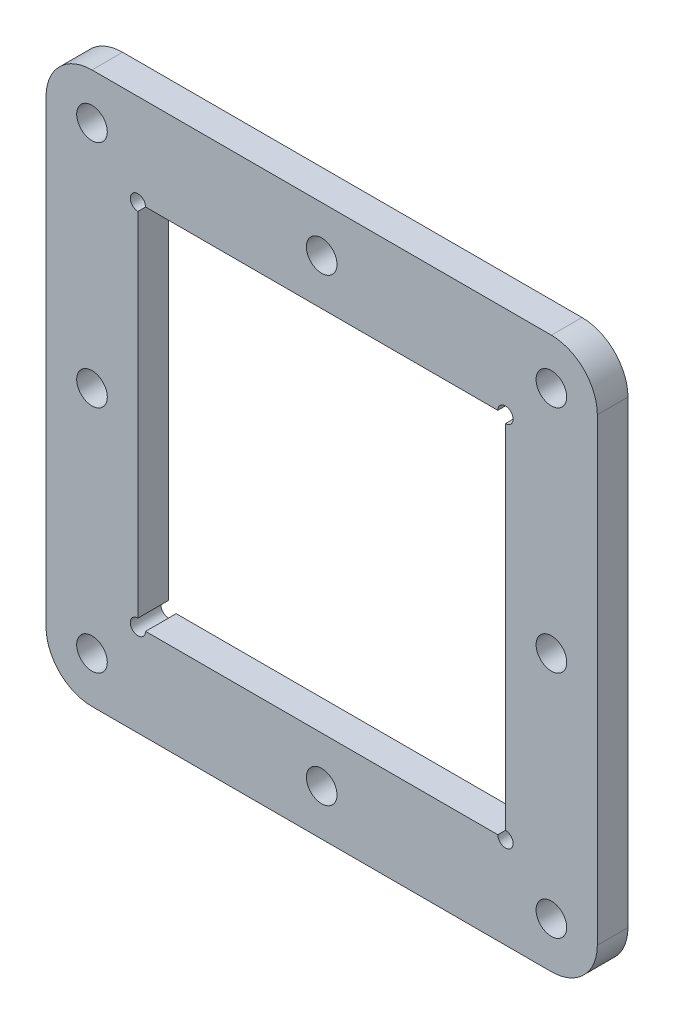
from build123d import *

# Parameters (mm, degrees)
SKETCH2_R           = 5
SKETCH2_W           = 120
SKETCH2_H           = 120
BOSS_EXTRUDE1_DEPTH = 10
SKETCH3_R           = 2.5
CUT_EXTRUDE1_DEPTH  = 10


with BuildPart() as part:
    # Sketch2 → Boss-Extrude1 (new body)
    with BuildSketch(Plane.XY):
        with BuildLine():
            Line((-75, 90), (75, 90))
            ThreePointArc((75, 90), (85.606601718, 85.606601718), (90, 75))
            Line((90, 75), (90, -75))
            ThreePointArc((90, -75), (85.606601718, -85.606601718), (75, -90))
            Line((75, -90), (-75, -90))
            ThreePointArc((-75, -90), (-85.606601718, -85.606601718), (-90, -75))
            Line((-90, -75), (-90, 75))
            ThreePointArc((-90, 75), (-85.606601718, 85.606601718), (-75, 90))
        make_face()
        with Locations((-75, 75)):
            Circle(SKETCH2_R, mode=Mode.SUBTRACT)
        with Locations((0, 75)):
            Circle(SKETCH2_R, mode=Mode.SUBTRACT)
        with Locations((75, 75)):
            Circle(SKETCH2_R, mode=Mode.SUBTRACT)
        with Locations((-75, 0)):
            Circle(SKETCH2_R, mode=Mode.SUBTRACT)
        with Locations((75, 0)):
            Circle(SKETCH2_R, mode=Mode.SUBTRACT)
        with Locations((-75, -75)):
            Circle(SKETCH2_R, mode=Mode.SUBTRACT)
        with Locations((0, -75)):
            Circle(SKETCH2_R, mode=Mode.SUBTRACT)
        with Locations((75, -75)):
            Circle(SKETCH2_R, mode=Mode.SUBTRACT)
        Rectangle(SKETCH2_W, SKETCH2_H, mode=Mode.SUBTRACT)
    extrude(amount=BOSS_EXTRUDE1_DEPTH)

    # Sketch3 → Cut-Extrude1 (cut)
    with BuildSketch(Plane.XY.offset(10)):
        with Locations((-60, 60)):
            Circle(SKETCH3_R)
        with Locations((60, 60)):
            Circle(SKETCH3_R)
        with Locations((60, -60)):
            Circle(SKETCH3_R)
        with Locations((-60, -60)):
            Circle(SKETCH3_R)
    extrude(amount=-CUT_EXTRUDE1_DEPTH, mode=Mode.SUBTRACT)


solid = part.part
